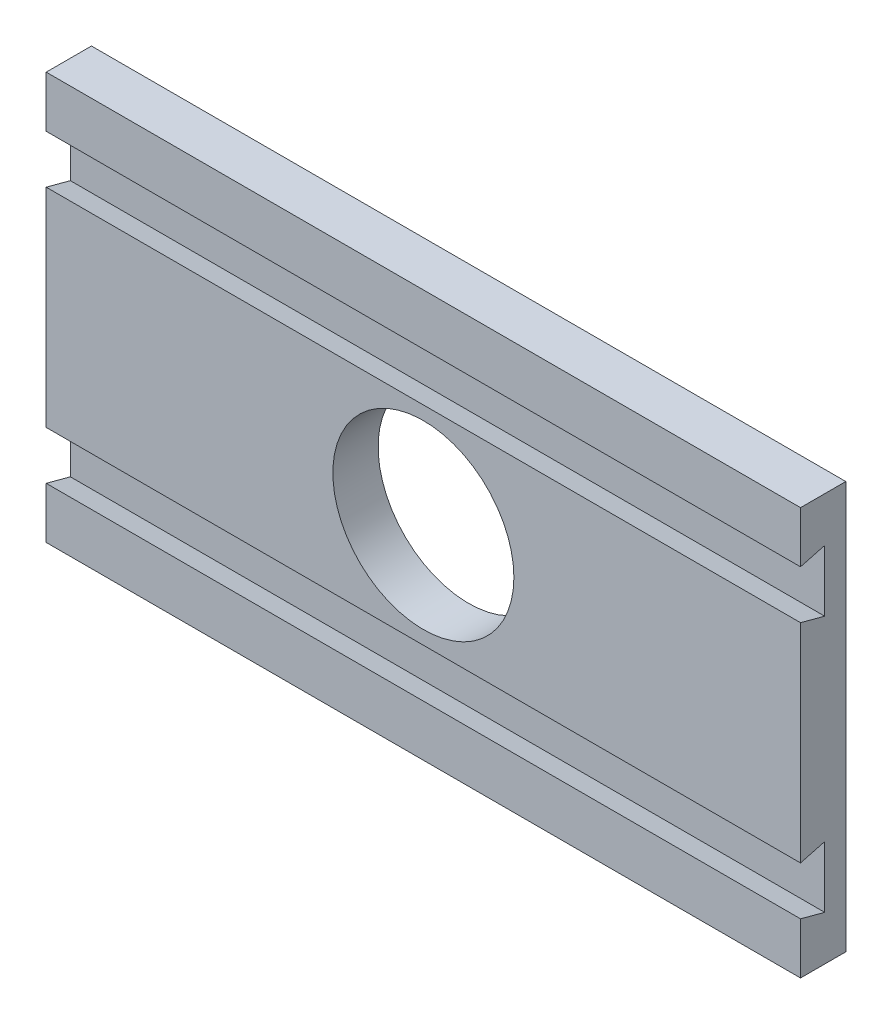
from build123d import *

# Parameters (mm, degrees)
PLATE_PROFILE_W             = 100
PLATE_PROFILE_H             = 54
PLATE_PROFILE_R             = 12
PLATE_6MM_DEPTH             = 6
DOVETAIL_GROOVES_DEPTH      = 58.140178509
DOVETAIL_GROOVES_DEPTH_BACK = 58.140178509


with BuildPart() as part:
    # Plate profile → Plate 6mm (new body)
    with BuildSketch(Plane.XY):
        Rectangle(PLATE_PROFILE_W, PLATE_PROFILE_H)
        Circle(PLATE_PROFILE_R, mode=Mode.SUBTRACT)
    extrude(amount=-PLATE_6MM_DEPTH)

    # Groove profiles → Dovetail grooves (cut, two sides: drawn at the far end of the back side and taken through both)
    with BuildSketch(Plane(origin=(0, 0, 0), x_dir=(0, 0, -1), z_dir=(1, 0, 0)).offset(-DOVETAIL_GROOVES_DEPTH_BACK)):
        Polygon((-0.2, 13.846344337), (3.2, 12.939677671), (3.2, 21.060322329), (-0.2, 20.153655663), align=None)
        Polygon((-0.2, -13.846344337), (3.2, -12.939677671), (3.2, -21.060322329), (-0.2, -20.153655663), align=None)
    extrude(amount=DOVETAIL_GROOVES_DEPTH + DOVETAIL_GROOVES_DEPTH_BACK, mode=Mode.SUBTRACT)


solid = part.part
